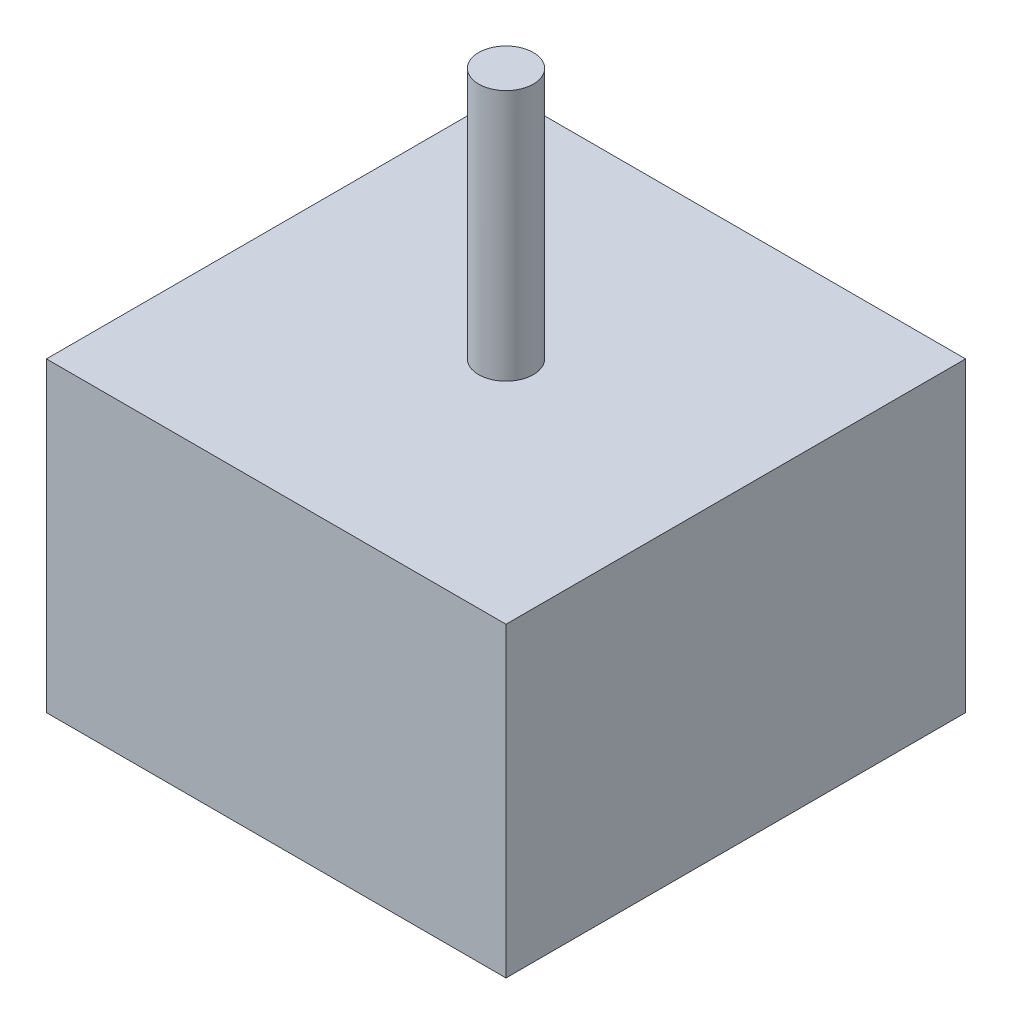
from build123d import *

# Parameters (mm, degrees)
SKETCH_1_W      = 42
SKETCH_1_H      = 28
EXTRUDE_1_DEPTH = 42
SKETCH_2_R      = 2.5
EXTRUDE_2_DEPTH = 23


with BuildPart() as part:
    # 草图1 → 凸台-拉伸1 (new body)
    with BuildSketch(Plane(origin=(0, 0, 0), x_dir=(0, 0, -1), z_dir=(1, 0, 0))):
        with Locations((21, 14)):
            Rectangle(SKETCH_1_W, SKETCH_1_H)
    extrude(amount=EXTRUDE_1_DEPTH)

    # 草图2 → 凸台-拉伸2 (add)
    with BuildSketch(Plane(origin=(0, 28, 0), x_dir=(1, 0, 0), z_dir=(0, 1, 0))):
        with Locations(Location((21, 21, 0), (0, 0, 90))):
            Circle(SKETCH_2_R)
    extrude(amount=EXTRUDE_2_DEPTH)


solid = part.part
